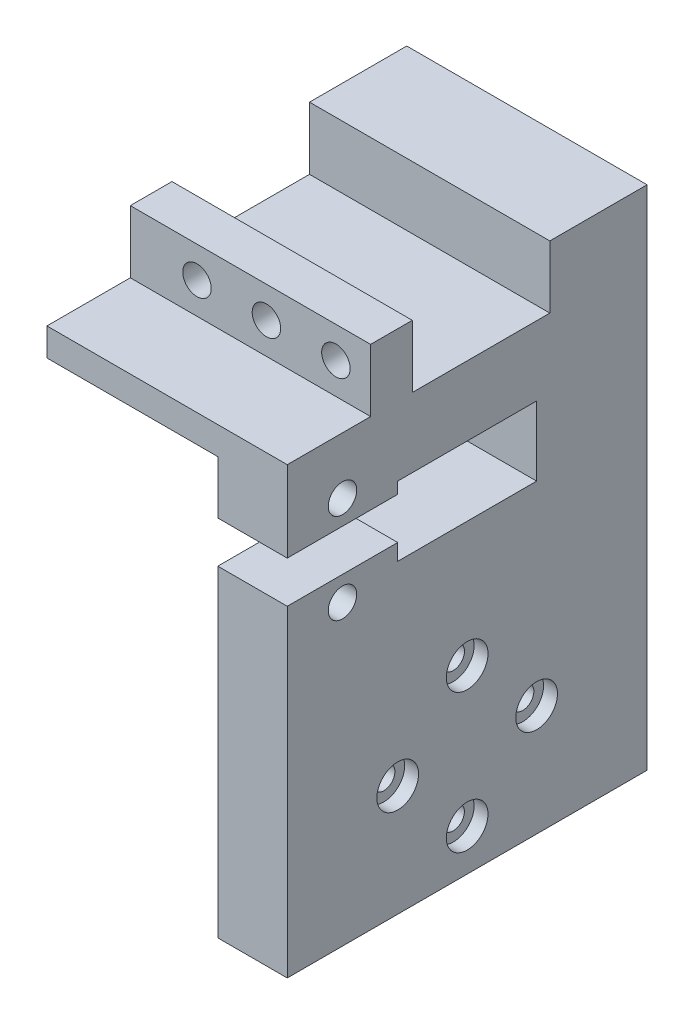
from build123d import *

# Parameters (mm, degrees)
SKETCH_1_W          = 30
SKETCH_1_H          = 39.8
EXTRUDE_1_DEPTH     = 4
SKETCH_2_W          = 30
SKETCH_2_H          = 14
EXTRUDE_2_DEPTH     = 9
SKETCH_3_W          = 30
SKETCH_3_H          = 6
EXTRUDE_3_DEPTH     = 9
SKETCH_4_W          = 10
SKETCH_4_H          = 39.8
EXTRUDE_4_DEPTH     = 60
SKETCH_5_W          = 20
SKETCH_5_H          = 10
CUT_EXTRUDE_1_DEPTH = 70.971494196
SKETCH_6_W          = 3.9
SKETCH_6_H          = 6
CUT_EXTRUDE_2_DEPTH = 70.971494196
SKETCH_8_W          = 12
SKETCH_8_H          = 4
EXTRUDE_5_DEPTH     = 30
SKETCH_9_W          = 12
SKETCH_9_H          = 7.651073012
SKETCH_9_H_2        = 46.348926988
EXTRUDE_6_DEPTH     = 10
SKETCH_13_R         = 1.6
SKETCH_13_R_2       = 1.615
CUT_EXTRUDE_3_DEPTH = 71.835090174
SKETCH_14_R         = 3
CUT_EXTRUDE_4_DEPTH = 2
CUT_EXTRUDE_5_REACH = 75.546
SKETCH_16_R         = 2.05
SKETCH_18_R         = 2.05
CUT_EXTRUDE_7_DEPTH = 71.835090174
STOPPER_DEPTH       = 4.6


with BuildPart() as part:
    # 草图1 → 凸台-拉伸1 (new body)
    with BuildSketch(Plane(origin=(0, 0, 0), x_dir=(1, 0, 0), z_dir=(0, 1, 0))):
        Rectangle(SKETCH_1_W, SKETCH_1_H)
    extrude(amount=EXTRUDE_1_DEPTH)

    # 草图2 → 凸台-拉伸2 (add)
    with BuildSketch(Plane(origin=(0, 4, 0), x_dir=(1, 0, 0), z_dir=(0, 1, 0))):
        with Locations((0, 12.9)):
            Rectangle(SKETCH_2_W, SKETCH_2_H)
    extrude(amount=EXTRUDE_2_DEPTH)

    # 草图3 → 凸台-拉伸3 (add)
    with BuildSketch(Plane(origin=(0, 4, 0), x_dir=(1, 0, 0), z_dir=(0, 1, 0))):
        with Locations((0, -16.9)):
            Rectangle(SKETCH_3_W, SKETCH_3_H)
    extrude(amount=EXTRUDE_3_DEPTH)

    # 草图4 → 凸台-拉伸4 (add)
    with BuildSketch(Plane(origin=(0, 0, 0), x_dir=(-1, 0, 0), z_dir=(0, -1, 0))):
        with Locations((-10, 0)):
            Rectangle(SKETCH_4_W, SKETCH_4_H)
    extrude(amount=EXTRUDE_4_DEPTH)

    # 草图5 → 切除-拉伸1 (cut, through all)
    with BuildSketch(Plane(origin=(15, 0, 0), x_dir=(0, 0, -1), z_dir=(1, 0, 0))):
        with Locations((-6, -11)):
            Rectangle(SKETCH_5_W, SKETCH_5_H)
    extrude(amount=-CUT_EXTRUDE_1_DEPTH, mode=Mode.SUBTRACT)

    # 草图6 → 切除-拉伸2 (cut, through all)
    with BuildSketch(Plane(origin=(15, 0, 0), x_dir=(0, 0, -1), z_dir=(1, 0, 0))):
        with Locations((-17.95, -10.651073012)):
            Rectangle(SKETCH_6_W, SKETCH_6_H)
    extrude(amount=-CUT_EXTRUDE_2_DEPTH, mode=Mode.SUBTRACT)

    # 草图8 → 凸台-拉伸5 (add)
    with BuildSketch(Plane.ZY.offset(15)):
        with Locations((25.9, 2)):
            Rectangle(SKETCH_8_W, SKETCH_8_H)
    extrude(amount=-EXTRUDE_5_DEPTH)

    # 草图9 → 凸台-拉伸6 (add)
    with BuildSketch(Plane.ZY.offset(-5)):
        with Locations((25.9, -3.825536506)):
            Rectangle(SKETCH_9_W, SKETCH_9_H)
        with Locations((25.9, -36.825536506)):
            Rectangle(SKETCH_9_W, SKETCH_9_H_2)
    extrude(amount=-EXTRUDE_6_DEPTH)

    # 草图13 → 切除-拉伸3 (cut, through all)
    with BuildSketch(Plane.ZY.offset(-5)):
        with Locations((-4, -44)):
            Circle(SKETCH_13_R)
        with Locations((6, -34)):
            Circle(SKETCH_13_R_2)
        with Locations((16, -44)):
            Circle(SKETCH_13_R)
        with Locations((6, -54)):
            Circle(SKETCH_13_R)
    extrude(amount=-CUT_EXTRUDE_3_DEPTH, mode=Mode.SUBTRACT)

    # 草图14 → 切除-拉伸4 (cut)
    with BuildSketch(Plane(origin=(15, 0, 0), x_dir=(0, 0, -1), z_dir=(1, 0, 0))):
        with Locations((-6, -34)):
            Circle(SKETCH_14_R)
        with Locations((-16, -44)):
            Circle(SKETCH_14_R)
        with Locations((-6, -54)):
            Circle(SKETCH_14_R)
        with Locations((4, -44)):
            Circle(SKETCH_14_R)
    extrude(amount=-CUT_EXTRUDE_4_DEPTH, mode=Mode.SUBTRACT)

    # 草图16 → 切除-拉伸5 (cut, up to next)
    with BuildSketch(Plane.XY.offset(19.9), mode=Mode.PRIVATE) as cut_extrude_5_sk1:
        with Locations((-10, 8.5)):
            Circle(SKETCH_16_R)
    cut_extrude_5_tool1 = extrude(cut_extrude_5_sk1.sketch, amount=-CUT_EXTRUDE_5_REACH, mode=Mode.PRIVATE) & part.part
    # 草图16 → 切除-拉伸5 (cut, up to next)
    with BuildSketch(Plane.XY.offset(19.9), mode=Mode.PRIVATE) as cut_extrude_5_sk2:
        with Locations((0, 8.5)):
            Circle(SKETCH_16_R)
    cut_extrude_5_tool2 = extrude(cut_extrude_5_sk2.sketch, amount=-CUT_EXTRUDE_5_REACH, mode=Mode.PRIVATE) & part.part
    # 草图16 → 切除-拉伸5 (cut, up to next)
    with BuildSketch(Plane.XY.offset(19.9), mode=Mode.PRIVATE) as cut_extrude_5_sk3:
        with Locations((10, 8.5)):
            Circle(SKETCH_16_R)
    cut_extrude_5_tool3 = extrude(cut_extrude_5_sk3.sketch, amount=-CUT_EXTRUDE_5_REACH, mode=Mode.PRIVATE) & part.part
    add(cut_extrude_5_tool1.solids().sort_by_distance((-10, 8.5, 19.9))[0], mode=Mode.SUBTRACT)
    add(cut_extrude_5_tool2.solids().sort_by_distance((0, 8.5, 19.9))[0], mode=Mode.SUBTRACT)
    add(cut_extrude_5_tool3.solids().sort_by_distance((10, 8.5, 19.9))[0], mode=Mode.SUBTRACT)

    # 草图18 → 切除-拉伸7 (cut, through all)
    with BuildSketch(Plane.ZY.offset(-5)):
        with Locations((23.95, -4.151073012)):
            Circle(SKETCH_18_R)
        with Locations((23.95, -17.151073012)):
            Circle(SKETCH_18_R)
    extrude(amount=-CUT_EXTRUDE_7_DEPTH, mode=Mode.SUBTRACT)

    # 草图21 → Stopper (add)
    with BuildSketch(Plane.ZY.offset(15)):
        Polygon((31.9, 0), (31.9, 4), (19.9, 4), (19.9, 13), (13.9, 13), (13.9, 4), (-5.9, 4), (-5.9, 13), (-19.9, 13), (-19.9, 0), align=None)
    extrude(amount=STOPPER_DEPTH)


solid = part.part
